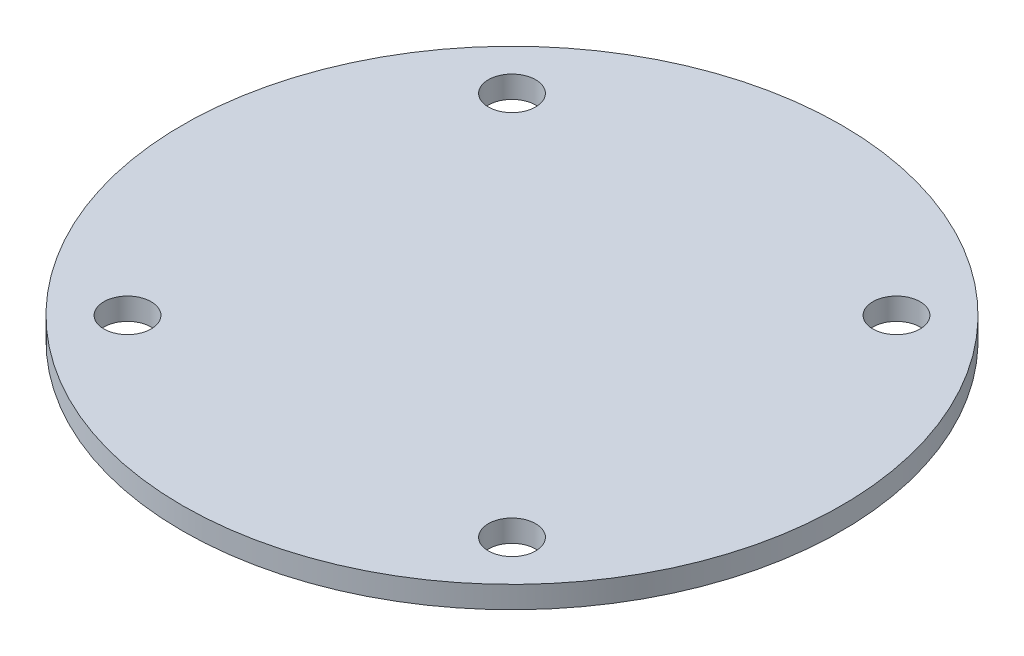
from build123d import *

# Parameters (mm, degrees)
SKETCH2_R             = 30
ACRYLICBASE_DEPTH     = 2
F_8_CLEARANCE_HOLE2_D = 4.3053


with BuildPart() as part:
    # Sketch2 → AcrylicBase (new body)
    with BuildSketch(Plane(origin=(0, 0, 0), x_dir=(1, 0, 0), z_dir=(0, 1, 0))):
        Circle(SKETCH2_R)
    extrude(amount=-ACRYLICBASE_DEPTH)

    # #8 Clearance Hole2 (through all)
    with Locations(Plane(origin=(0, 0, 0), x_dir=(-1, 0, 0), z_dir=(0, 1, 0))):
        with Locations((17.5, -17.5), (-17.5, -17.5), (-17.5, 17.5), (17.5, 17.5)):
            Hole(F_8_CLEARANCE_HOLE2_D / 2)


solid = part.part
